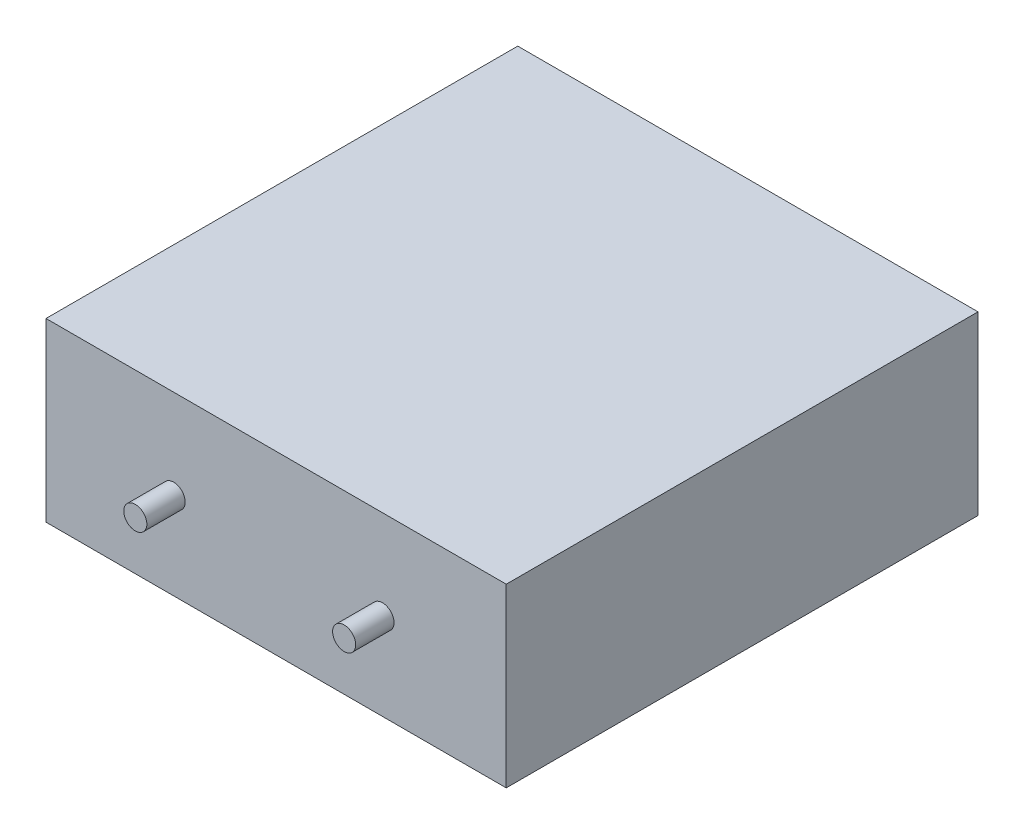
from build123d import *

# Parameters (mm, degrees)
SKIZZE1_W                       = 120
SKIZZE1_H                       = 123
AUFSATZ_LINEAR_AUSTRAGEN1_DEPTH = 46
SKIZZE2_R                       = 3.007311743
AUFSATZ_LINEAR_AUSTRAGEN2_DEPTH = 10


with BuildPart() as part:
    # Skizze1 → Aufsatz-Linear austragen1 (new body)
    with BuildSketch(Plane(origin=(0, 0, 0), x_dir=(1, 0, 0), z_dir=(0, 1, 0))):
        Rectangle(SKIZZE1_W, SKIZZE1_H)
    extrude(amount=AUFSATZ_LINEAR_AUSTRAGEN1_DEPTH)

    # Skizze2 → Aufsatz-Linear austragen2 (add)
    with BuildSketch(Plane.XY.offset(61.5)):
        with Locations(Location((-26.717027071, 22.669789553, 0), (0, 0, 180))):
            Circle(SKIZZE2_R)
        with Locations(Location((27.737677543, 22.669789553, 0), (0, 0, 180))):
            Circle(SKIZZE2_R)
    extrude(amount=AUFSATZ_LINEAR_AUSTRAGEN2_DEPTH)


solid = part.part
